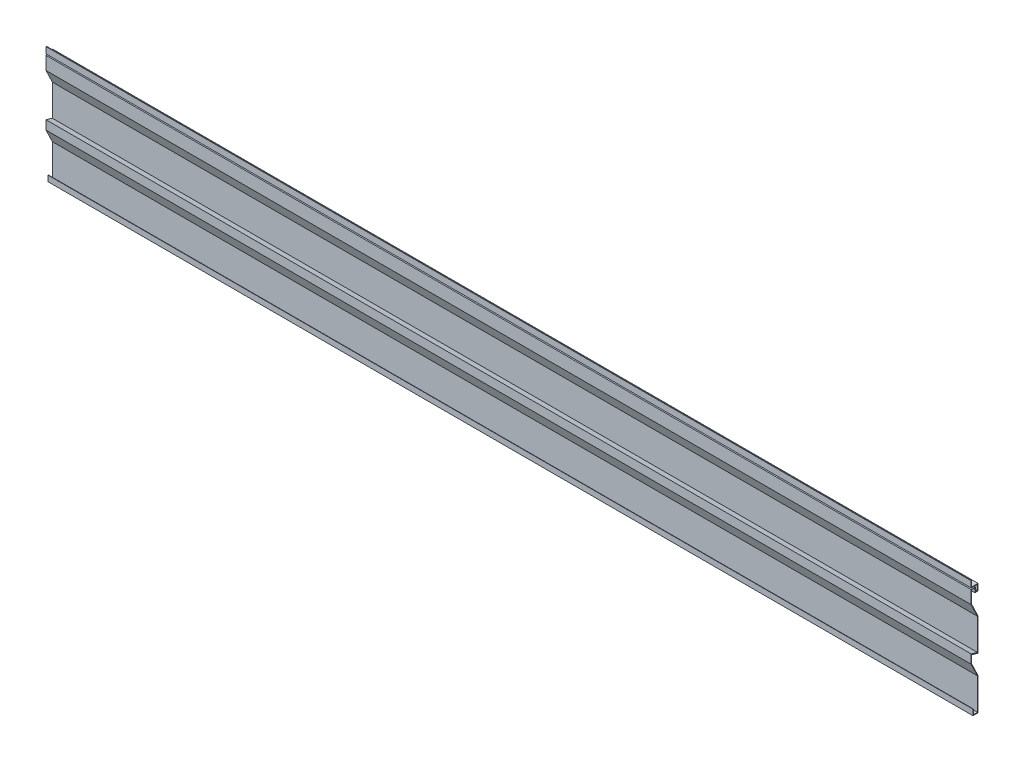
from build123d import *

# Parameters (mm, degrees)
EXTRUDE_1_DEPTH = 1830


with BuildPart() as part:
    # Эскиз1 → Бобышка-Вытянуть1 (new body)
    with BuildSketch(Plane(origin=(0, 0, 0), x_dir=(0, 0, -1), z_dir=(1, 0, 0))):
        Polygon((-21.04046283, -176.74277017), (-11.04046283, -176.74277017), (-11.04046283, -112.74277017), (-23.447393592, -86.746885797), (-23.447393592, -71.14960141), (-11.04046283, -74.694438771), (-11.04046283, -10.694438771), (-23.447393592, 15.301445602), (-23.447393592, 40.305561229), (-17.243928211, 40.305561229), (-17.243928211, 32.005165785), (-11.04046283, 32.005165785), (-11.04046283, 45.121064019), (-23.447393592, 45.121064019), (-23.447393592, 56.305561229), (-24.507119661, 56.305561229), (-24.507119661, 43.820437884), (-12.100188898, 43.820437884), (-12.100188898, 33.361087922), (-16.2229249, 33.361087922), (-16.2229249, 41.232557481), (-24.507119661, 41.232557481), (-24.507119661, 15.301445602), (-12.100188898, -10.694438771), (-12.100188898, -72.620716315), (-24.507119661, -69.075878954), (-24.507119661, -86.746885797), (-12.100188898, -112.74277017), (-12.100188898, -175.263961293), (-20.345660902, -175.263961293), (-20.345660902, -165.442275203), (-21.04046283, -165.442275203), align=None)
    extrude(amount=EXTRUDE_1_DEPTH)


solid = part.part
